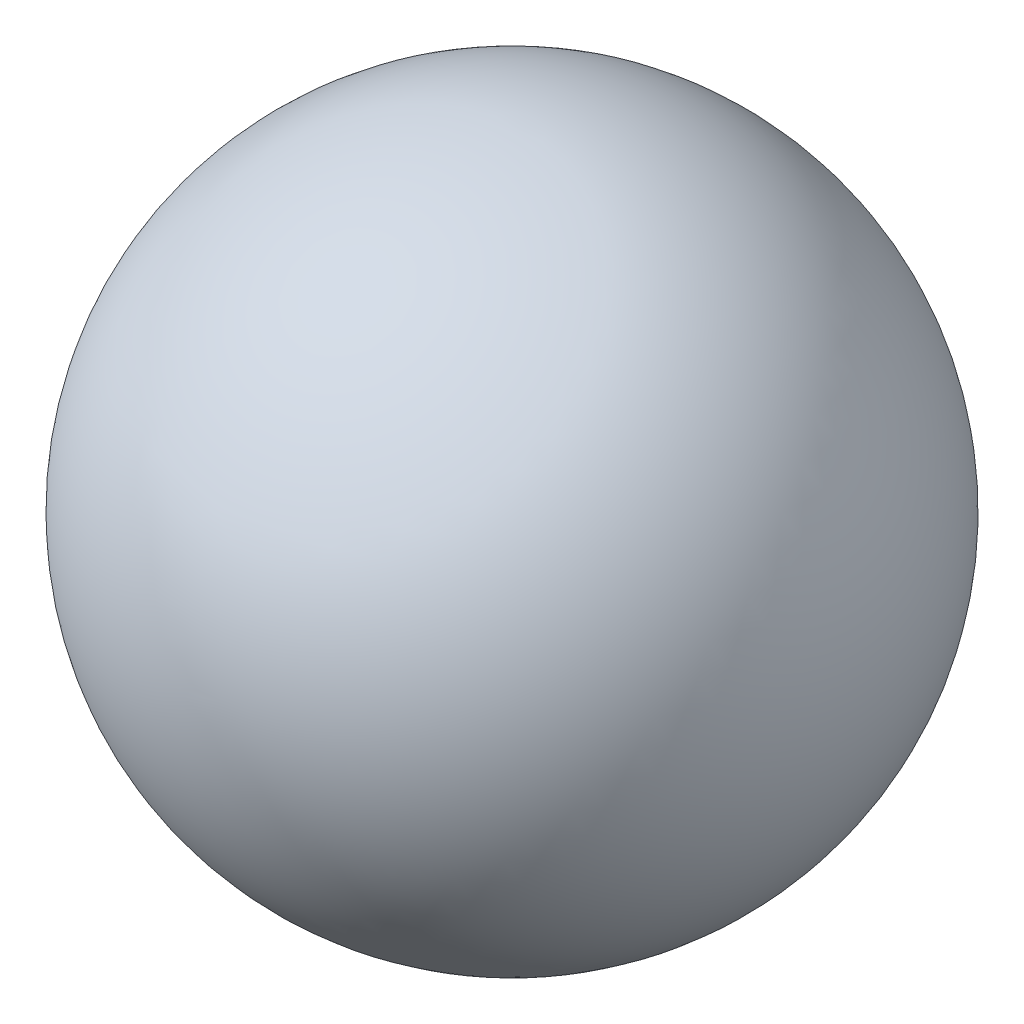
from build123d import *

# Parameters (mm, degrees)
SKETCH_2_R          = 2.5
CUT_EXTRUDE_1_DEPTH = 18.320508076


with BuildPart() as part:
    # 草图1 → 旋转1 (revolve)
    with BuildSketch(Plane(origin=(0, 0, 0), x_dir=(1, 0, 0), z_dir=(0, 1, 0))):
        with BuildLine():
            Line((0, 10), (0, -10))
            ThreePointArc((0, -10), (10, 0), (0, 10))
        make_face()
    revolve(axis=Axis((0, 0, -37.198504184), (0, 0, 1)))

    # 草图2 → 切除-拉伸1 (cut, through all)
    with BuildSketch(Plane(origin=(0, 0, 0), x_dir=(1, 0, 0), z_dir=(0, 1, 0))):
        with Locations(Location((0, 0, 0), (0, 0, 270))):
            Circle(SKETCH_2_R)
    extrude(amount=-CUT_EXTRUDE_1_DEPTH, mode=Mode.SUBTRACT)


solid = part.part
